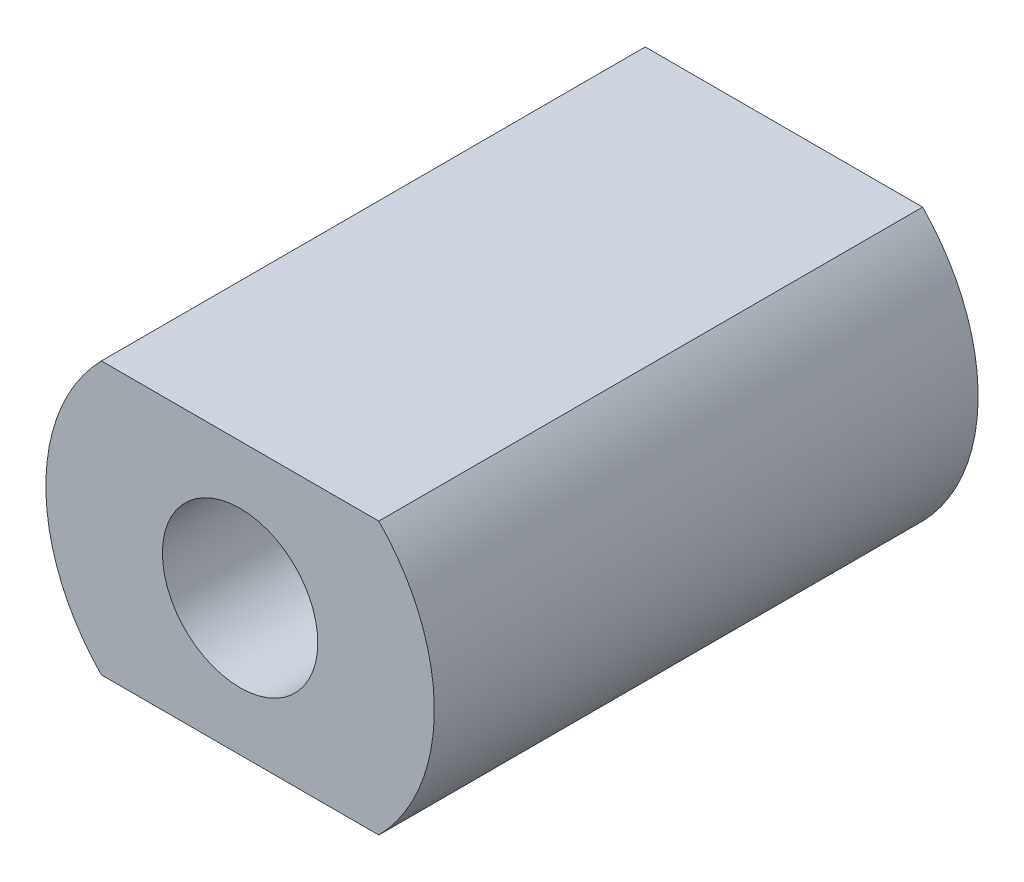
from build123d import *

# Parameters (mm, degrees)
SKETCH1_R           = 1
BOSS_EXTRUDE1_DEPTH = 7


with BuildPart() as part:
    # Sketch1 → Boss-Extrude1 (new body)
    with BuildSketch(Plane.XY):
        with BuildLine():
            Line((-1.785357107, 1.75), (1.785357107, 1.75))
            ThreePointArc((1.785357107, 1.75), (2.5, 0), (1.785357107, -1.75))
            Line((1.785357107, -1.75), (-1.785357107, -1.75))
            ThreePointArc((-1.785357107, -1.75), (-2.5, 0), (-1.785357107, 1.75))
        make_face()
        Circle(SKETCH1_R, mode=Mode.SUBTRACT)
    extrude(amount=BOSS_EXTRUDE1_DEPTH)


solid = part.part
